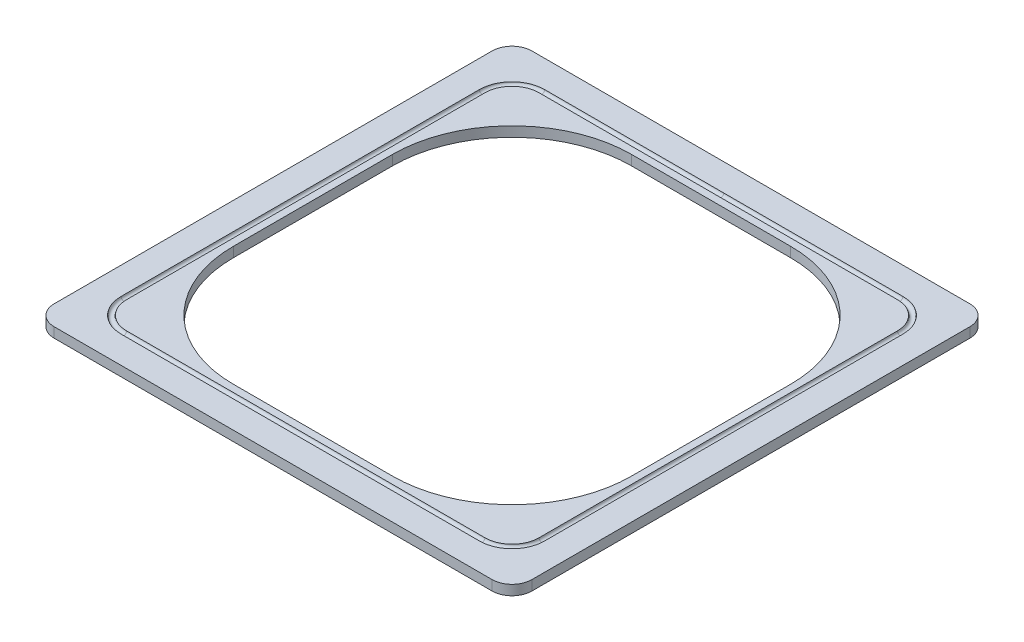
from build123d import *

# Parameters (mm, degrees)
SKETCH1_W           = 304.8
SKETCH1_H           = 304.8
SKETCH1_W_2         = 254
SKETCH1_H_2         = 254
BOSS_EXTRUDE1_DEPTH = 6.35
FILLET1_R           = 76.2
FILLET2_R           = 12.7
SKETCH4_R           = 1.7653


with BuildPart() as part:
    # Sketch1 → Boss-Extrude1 (new body)
    with BuildSketch(Plane(origin=(0, 0, 0), x_dir=(1, 0, 0), z_dir=(0, 1, 0))):
        Rectangle(SKETCH1_W, SKETCH1_H)
        Rectangle(SKETCH1_W_2, SKETCH1_H_2, mode=Mode.SUBTRACT)
    extrude(amount=BOSS_EXTRUDE1_DEPTH)

    # Fillet1
    fillet1_edges = [part.edges().sort_by_distance(p)[0] for p in [
        (-127, 3.175, -127),
        (-127, 3.175, 127),
        (127, 3.175, 127),
        (127, 3.175, -127),
    ]]
    fillet(fillet1_edges, radius=FILLET1_R)

    # Fillet2
    fillet2_edges = [part.edges().sort_by_distance(p)[0] for p in [
        (152.4, 3.175, 152.4),
        (-152.4, 3.175, 152.4),
        (-152.4, 3.175, -152.4),
        (152.4, 3.175, -152.4),
    ]]
    fillet(fillet2_edges, radius=FILLET2_R)

    # Cut-Sweep1: sweep along a path in Sketch3
    with BuildLine(Plane(origin=(0, 6.35, 0), x_dir=(1, 0, 0), z_dir=(0, 1, 0))) as cut_sweep1_path:
        Line((114.3, -133.35), (-114.3, -133.35))
        ThreePointArc((-114.3, -133.35), (-127.770384182, -127.770384182), (-133.35, -114.3))
        Line((-133.35, -114.3), (-133.35, 114.3))
        ThreePointArc((-133.35, 114.3), (-127.770384182, 127.770384182), (-114.3, 133.35))
        Line((-114.3, 133.35), (114.3, 133.35))
        ThreePointArc((114.3, 133.35), (127.770384182, 127.770384182), (133.35, 114.3))
        Line((133.35, 114.3), (133.35, -114.3))
        ThreePointArc((133.35, -114.3), (127.770384182, -127.770384182), (114.3, -133.35))
    # Sketch4 → Cut-Sweep1 (sweep, cut)
    with BuildSketch(Plane(origin=(0, 0, 0), x_dir=(0, 0, -1), z_dir=(1, 0, 0))):
        with Locations((133.35, 6.35)):
            Circle(SKETCH4_R)
    sweep(path=cut_sweep1_path.line, mode=Mode.SUBTRACT)


solid = part.part
